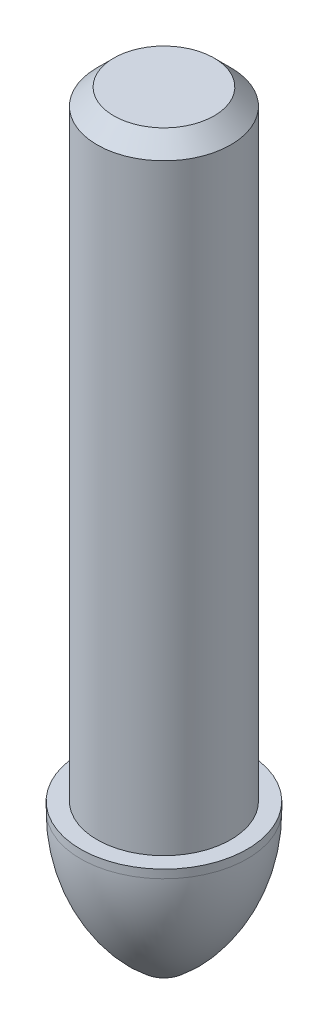
from build123d import *

# Parameters (mm, degrees)
CHAMFER1_SIZE = 1


with BuildPart() as part:
    # Sketch1 → Revolve1 (revolve)
    with BuildSketch(Plane.XY, mode=Mode.PRIVATE) as revolve1_sk:
        with BuildLine():
            Line((0, 0), (4, 0))
            Line((4, 0), (4, -37))
            Line((4, -37), (4.985, -37))
            Line((4.985, -37), (4.985, -37.5))
            ThreePointArc((4.985, -37.5), (4.003137517, -41.814427421), (1.250941029, -45.279070605))
            ThreePointArc((1.250941029, -45.279070605), (0.662951274, -45.605502555), (0, -45.718574998))
            Line((0, -45.718574998), (0, 0))
        make_face()
    revolve(revolve1_sk.sketch.rotate(Axis((0, 0, 0), (0, -1, 0)), 180), axis=Axis((0, 0, 0), (0, -1, 0)))

    # Chamfer1
    chamfer1_edges = [part.edges().sort_by_distance(p)[0] for p in [
        (4, 0, 0),
    ]]
    chamfer(chamfer1_edges, length=CHAMFER1_SIZE)


solid = part.part
